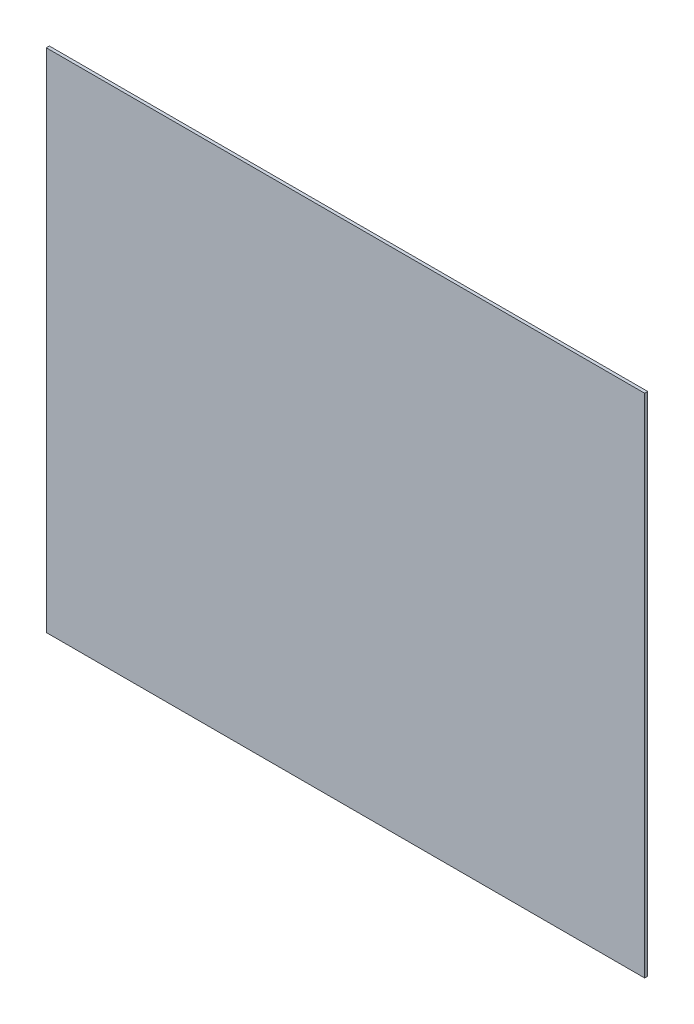
from build123d import *

# Parameters (mm, degrees)
BOSS_EXTRUDE1_DEPTH = 3.18


with BuildPart() as part:
    # Sketch1 → Boss-Extrude1 (new body)
    with BuildSketch(Plane.XY):
        Polygon((-13.18, 13.18), (438.14, 13.18), (606.526220458, 13.18), (606.526220458, -511.36), (438.14, -511.36), (-13.18, -511.36), align=None)
    extrude(amount=BOSS_EXTRUDE1_DEPTH)


solid = part.part
